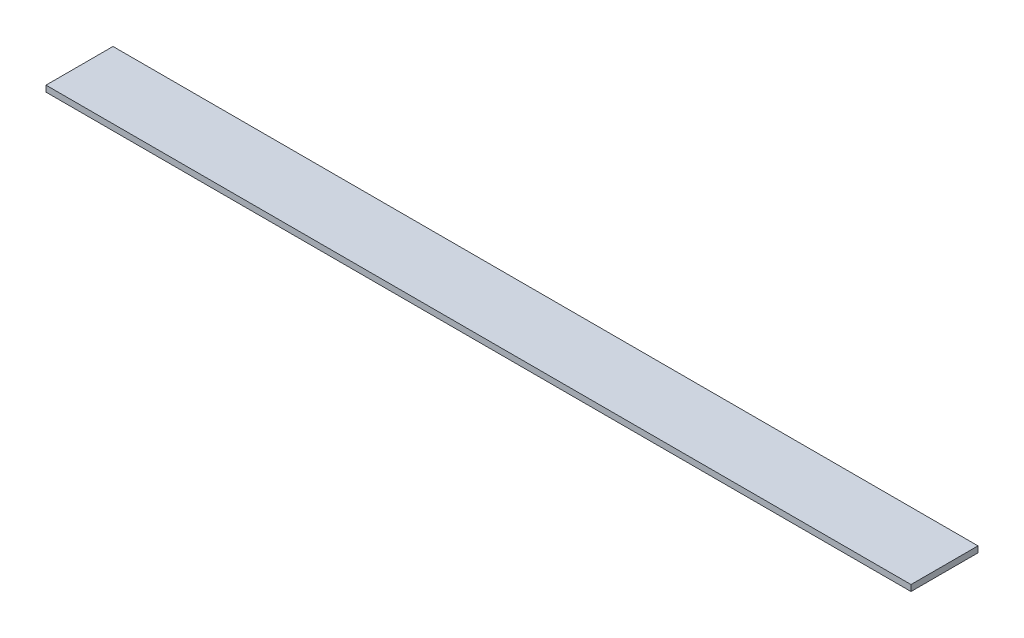
from build123d import *

# Parameters (mm, degrees)
SKETCH1_W           = 450.85
SKETCH1_H           = 34.925
BOSS_EXTRUDE1_DEPTH = 3.175


with BuildPart() as part:
    # Sketch1 → Boss-Extrude1 (new body)
    with BuildSketch(Plane(origin=(0, 0, 0), x_dir=(1, 0, 0), z_dir=(0, 1, 0))):
        with Locations((225.425, 17.4625)):
            Rectangle(SKETCH1_W, SKETCH1_H)
    extrude(amount=BOSS_EXTRUDE1_DEPTH)


solid = part.part
